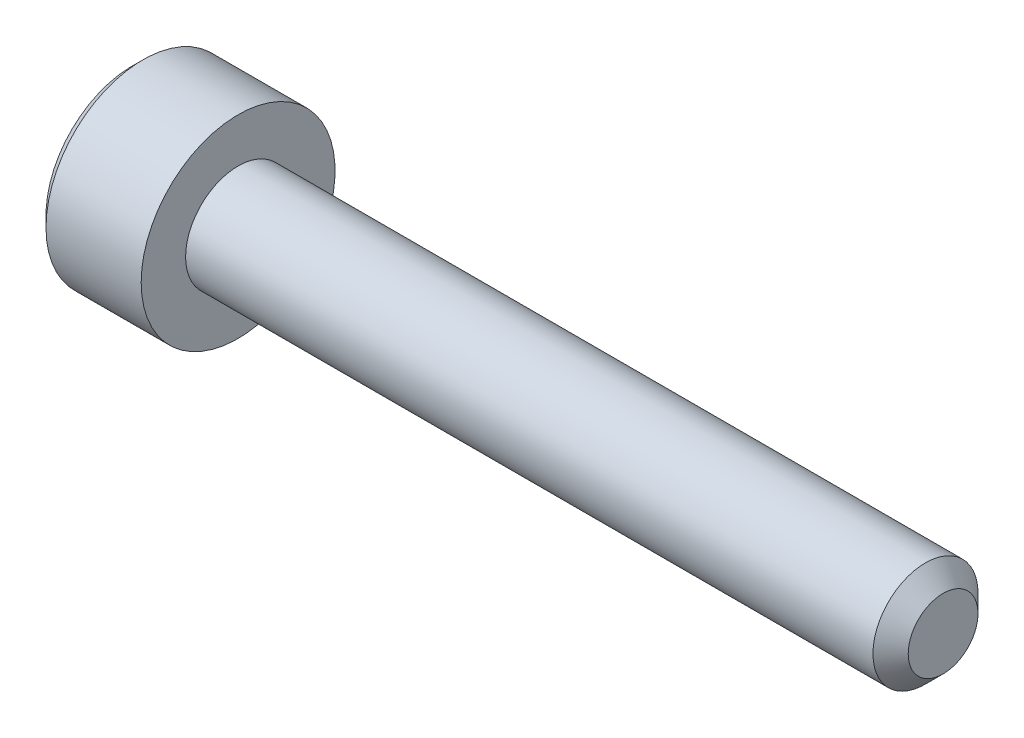
from build123d import *

# Parameters (mm, degrees)
CHAMFER1_SIZE      = 0.5
CHAMFER2_SIZE      = 0.3
CUT_EXTRUDE1_DEPTH = 2.5
CHAMFER3_SIZE      = 0.3


with BuildPart() as part:
    # Sketch1 → Revolve1 (revolve)
    with BuildSketch(Plane.XY, mode=Mode.PRIVATE) as revolve1_sk:
        Polygon((0, 0), (0, 2.75), (3, 2.75), (3, 1.49), (23, 1.49), (23, 0), align=None)
    revolve(revolve1_sk.sketch.rotate(Axis((-88.705490849, 0, 0), (1, 0, 0)), 90), axis=Axis((-88.705490849, 0, 0), (1, 0, 0)))

    # Chamfer1
    chamfer1_edges = [part.edges().sort_by_distance(p)[0] for p in [
        (23, 0, -1.49),
    ]]
    chamfer(chamfer1_edges, length=CHAMFER1_SIZE)

    # Chamfer2
    chamfer2_edges = [part.edges().sort_by_distance(p)[0] for p in [
        (0, 0, -2.75),
    ]]
    chamfer(chamfer2_edges, length=CHAMFER2_SIZE)

    # Sketch3 → Cut-Extrude1 (cut)
    with BuildSketch(Plane(origin=(0, 0, 0), x_dir=(0, 0, -1), z_dir=(1, 0, 0))):
        Polygon((-1.443375673, 0), (-0.721687836, -1.25), (0.721687836, -1.25), (1.443375673, 0), (0.721687836, 1.25), (-0.721687836, 1.25), align=None)
    extrude(amount=CUT_EXTRUDE1_DEPTH, mode=Mode.SUBTRACT)

    # Chamfer3
    chamfer3_edges = [part.edges().sort_by_distance(p)[0] for p in [
        (0, 0.625, 1.082531755),
        (0, -0.625, 1.082531755),
        (0, -1.25, 0),
        (0, -0.625, -1.082531755),
        (0, 0.625, -1.082531755),
        (0, 1.25, 0),
    ]]
    chamfer(chamfer3_edges, length=CHAMFER3_SIZE)


solid = part.part
